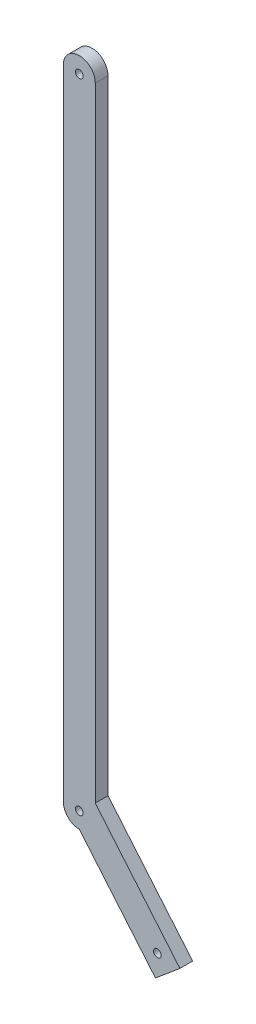
from build123d import *

# Parameters (mm, degrees)
SKETCH1_R           = 3
BOSS_EXTRUDE1_DEPTH = 10
SKETCH2_R           = 3
BOSS_EXTRUDE3_DEPTH = 10


with BuildPart() as part:
    # Sketch1 → Boss-Extrude1 (new body)
    with BuildSketch(Plane.XY):
        with BuildLine():
            Line((-12.5, 0), (-12.5, -500))
            ThreePointArc((-12.5, -500), (0, -512.5), (12.5, -500))
            Line((12.5, -500), (12.5, 0))
            ThreePointArc((12.5, 0), (0, 12.5), (-12.5, 0))
        make_face()
        Circle(SKETCH1_R, mode=Mode.SUBTRACT)
        with Locations(Location((0, -500, 0), (0, 0, 180))):
            Circle(SKETCH1_R, mode=Mode.SUBTRACT)
    extrude(amount=BOSS_EXTRUDE1_DEPTH)

    # Sketch2 → Boss-Extrude3 (add)
    with BuildSketch(Plane.XY.offset(10)):
        Polygon((12.5, -488.503824236), (78.810550707, -567.529661268), (59.659439629, -583.59935151), (0, -512.5), align=None)
        with Locations((61.200150047, -565.98895085)):
            Circle(SKETCH2_R, mode=Mode.SUBTRACT)
    extrude(amount=-BOSS_EXTRUDE3_DEPTH)


solid = part.part
